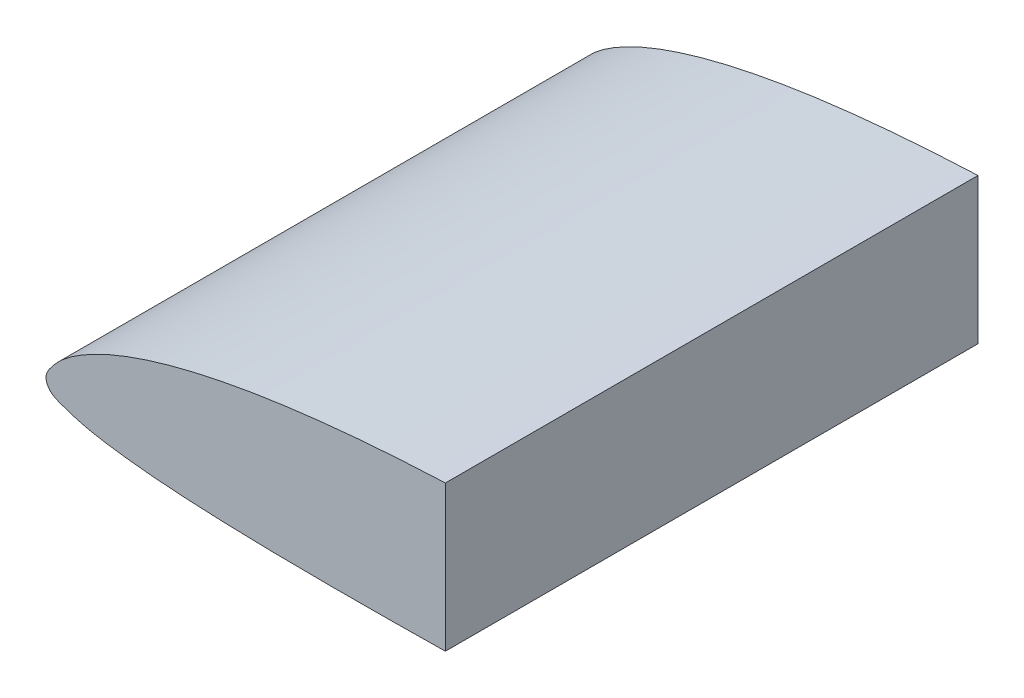
from build123d import *

# Parameters (mm, degrees)
BOSS_EXTRUDE1_DEPTH = 101.6
CUT_EXTRUDE1_REACH  = 323.991


with BuildPart() as part:
    # Sketch1 → Boss-Extrude1 (new body)
    with BuildSketch(Plane.XY):
        with BuildLine():
            add(Edge.make_bspline(
                [(304.8, 0), (304.801618835, 0.010540478), (302.668974732, 0.220720307), (300.521978172, 0.544561193), (295.368886495, 1.287532881), (289.160913878, 2.336451989), (281.213840869, 3.719528215), (272.021147759, 5.342488752), (261.611069809, 7.12581444), (250.148168886, 8.972268862), (237.729227105, 10.795518621), (224.466668829, 12.54594496), (210.486966245, 14.212118786), (195.93933438, 15.778639106), (180.985449003, 17.213469794), (165.790506747, 18.481340481), (150.517335734, 19.554998166), (135.325856865, 20.397631434), (120.373654992, 20.98340204), (105.81189191, 21.290160197), (91.783487426, 21.289103613), (78.421362096, 20.972495194), (65.846527594, 20.328825422), (54.167401708, 19.341879453), (43.474395079, 18.033016181), (33.848689519, 16.408163948), (25.35255061, 14.499540959), (18.039631385, 12.348915542), (11.931389638, 10.004037044), (7.088065074, 7.539743052), (3.409669417, 5.062999452), (1.150479012, 2.689475058), (-0.341456031, 0.40621392), (0.675206571, -2.003544456), (3.585886452, -3.093453589), (7.588464469, -4.354328919), (13.286800402, -5.287844632), (20.432221307, -6.083907263), (29.060168375, -6.639744455), (39.067939258, -6.99535451), (50.37384412, -7.15527669), (62.857254549, -7.147696164), (76.383896406, -6.993162883), (90.803190635, -6.698617972), (105.956834514, -6.283682576), (121.677348301, -5.770524523), (137.789976772, -5.175861802), (154.114864341, -4.517765803), (170.470018261, -3.81546046), (186.670857635, -3.100338029), (202.532085032, -2.390929036), (217.868391944, -1.724826971), (232.492823425, -1.114990963), (246.220887099, -0.613930049), (258.861467047, -0.215656423), (270.253080457, 0.055353876), (280.188997103, 0.219595784), (288.650498905, 0.274785104), (295.155593424, 0.2616867), (300.464576397, 0.143666174), (302.65962258, 0.115723261), (304.798389635, -0.010485328), (304.8, 0)],
                knots=[0, 0, 0, 0, 0.0016327, 0.006455835, 0.014273372, 0.024843793, 0.037882366, 0.053107741, 0.070262266, 0.08911225, 0.109473671, 0.131182791, 0.154044071, 0.177807645, 0.202201782, 0.226959755, 0.251816152, 0.276516239, 0.300807474, 0.324444283, 0.347208207, 0.368893733, 0.389313649, 0.408315169, 0.425773142, 0.441588353, 0.45567994, 0.468012176, 0.478566618, 0.4873628, 0.494418821, 0.499795181, 0.503597783, 0.506520219, 0.511061336, 0.517923775, 0.527204743, 0.538873846, 0.552882495, 0.569133331, 0.587485765, 0.607759265, 0.629725606, 0.653145174, 0.677762488, 0.703306432, 0.729490768, 0.756024037, 0.782609438, 0.808949563, 0.834737242, 0.859674704, 0.883459774, 0.905784827, 0.926349266, 0.944857553, 0.961054711, 0.974700529, 0.985589472, 0.993530515, 0.998375843, 1, 1, 1, 1], degree=3))
        make_face()
    extrude(amount=BOSS_EXTRUDE1_DEPTH)

    # Sketch2 → Cut-Extrude1 (cut, up to next)
    with BuildSketch(Plane.XY.offset(101.6), mode=Mode.PRIVATE) as cut_extrude1_sk1:
        Polygon((76.2, 491.503009109), (76.2, 20.824757853), (76.2, -6.975039847), (76.2, -477.653291104), (1017.556502514, -477.653291104), (1017.556502514, 491.503009109), align=None)
    cut_extrude1_tool1 = extrude(cut_extrude1_sk1.sketch, amount=-CUT_EXTRUDE1_REACH, mode=Mode.PRIVATE) & part.part
    add(cut_extrude1_tool1.solids().sort_by_distance((546.878251, 6.924859, 101.6))[0], mode=Mode.SUBTRACT)


solid = part.part
